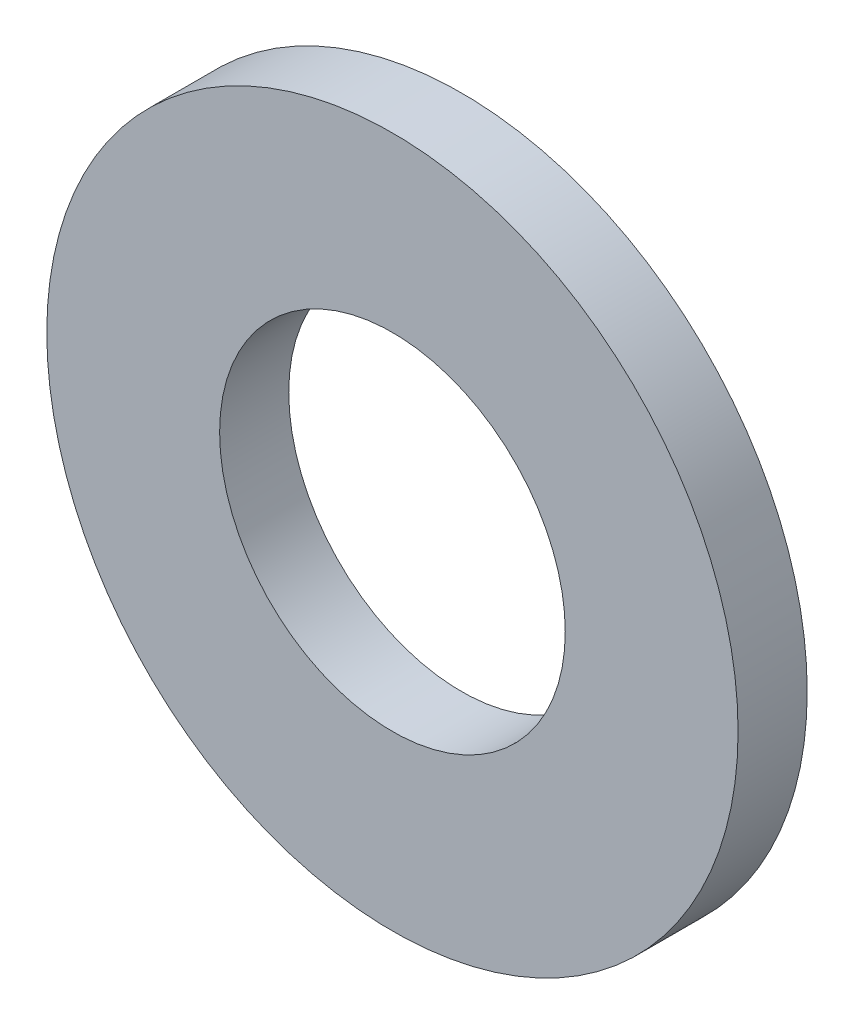
from build123d import *

# Parameters (mm, degrees)
SKETCH1_R           = 8
SKETCH1_R_2         = 4
BOSS_EXTRUDE1_DEPTH = 1.6


with BuildPart() as part:
    # Sketch1 → Boss-Extrude1 (new body)
    with BuildSketch(Plane.XY):
        Circle(SKETCH1_R)
        Circle(SKETCH1_R_2, mode=Mode.SUBTRACT)
    extrude(amount=BOSS_EXTRUDE1_DEPTH)


solid = part.part
